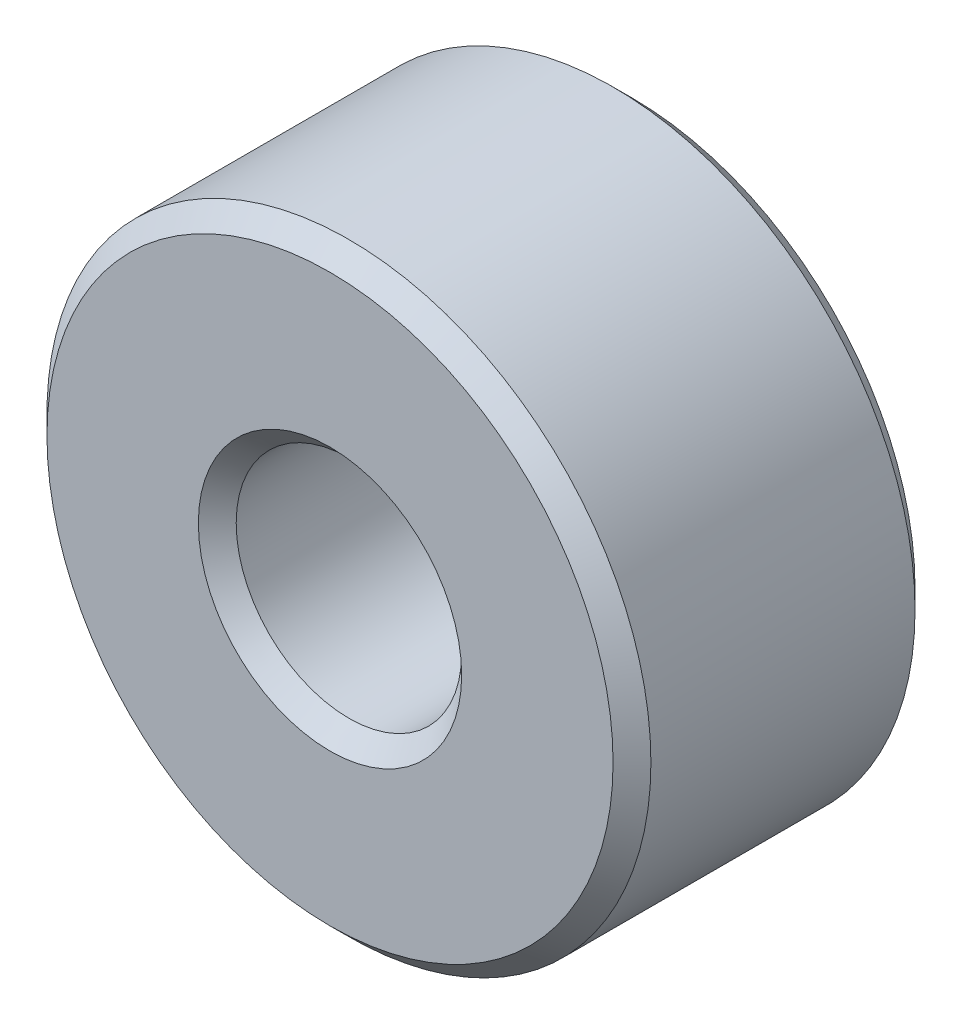
from build123d import *

# Parameters (mm, degrees)
BOSS_EXTRUDE1_DEPTH      = 2.38125
BOSS_EXTRUDE1_DEPTH_BACK = 2.38125
SKETCH3_R                = 4.7625
SKETCH3_R_2              = 1.778
CHAMFER1_SIZE            = 0.29845


with BuildPart() as part:
    # Sketch3 → Boss-Extrude1 (new, two sides: drawn at the far end of the back side and taken through both)
    with BuildSketch(Plane.XY.offset(-BOSS_EXTRUDE1_DEPTH_BACK)):
        Circle(SKETCH3_R)
        Circle(SKETCH3_R_2, mode=Mode.SUBTRACT)
    extrude(amount=BOSS_EXTRUDE1_DEPTH + BOSS_EXTRUDE1_DEPTH_BACK)

    # Chamfer1
    chamfer1_edges = [part.edges().sort_by_distance(p)[0] for p in [
        (-4.7625, 0, -2.38125),
        (-1.778, 0, -2.38125),
        (-4.7625, 0, 2.38125),
        (-1.778, 0, 2.38125),
    ]]
    chamfer(chamfer1_edges, length=CHAMFER1_SIZE)


solid = part.part
